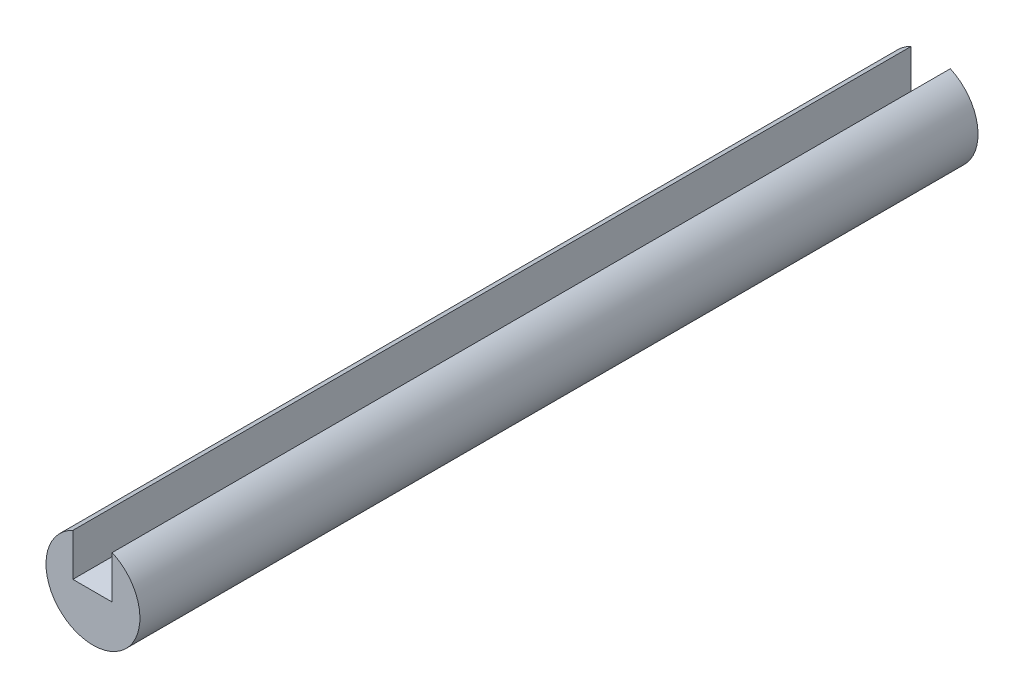
from build123d import *

# Parameters (mm, degrees)
BOSS_EXTRUDE1_DEPTH      = 80
BOSS_EXTRUDE1_DEPTH_BACK = 5
SKETCH1_R                = 4.7625
CUT_EXTRUDE2_DEPTH       = 85


with BuildPart() as part:
    # Sketch1 → Boss-Extrude1 (new, two sides: drawn at the far end of the back side and taken through both)
    with BuildSketch(Plane.XY.offset(-BOSS_EXTRUDE1_DEPTH_BACK)):
        Circle(SKETCH1_R)
    extrude(amount=BOSS_EXTRUDE1_DEPTH + BOSS_EXTRUDE1_DEPTH_BACK)

    # Sketch2 → Cut-Extrude2 (cut)
    with BuildSketch(Plane.XY.offset(80)):
        Polygon((0, 0), (1.950143724, 0), (1.950143724, 10.004054158), (-2.03949083, 10.004054158), (-2.03949083, 0), align=None)
    extrude(amount=-CUT_EXTRUDE2_DEPTH, mode=Mode.SUBTRACT)


solid = part.part
